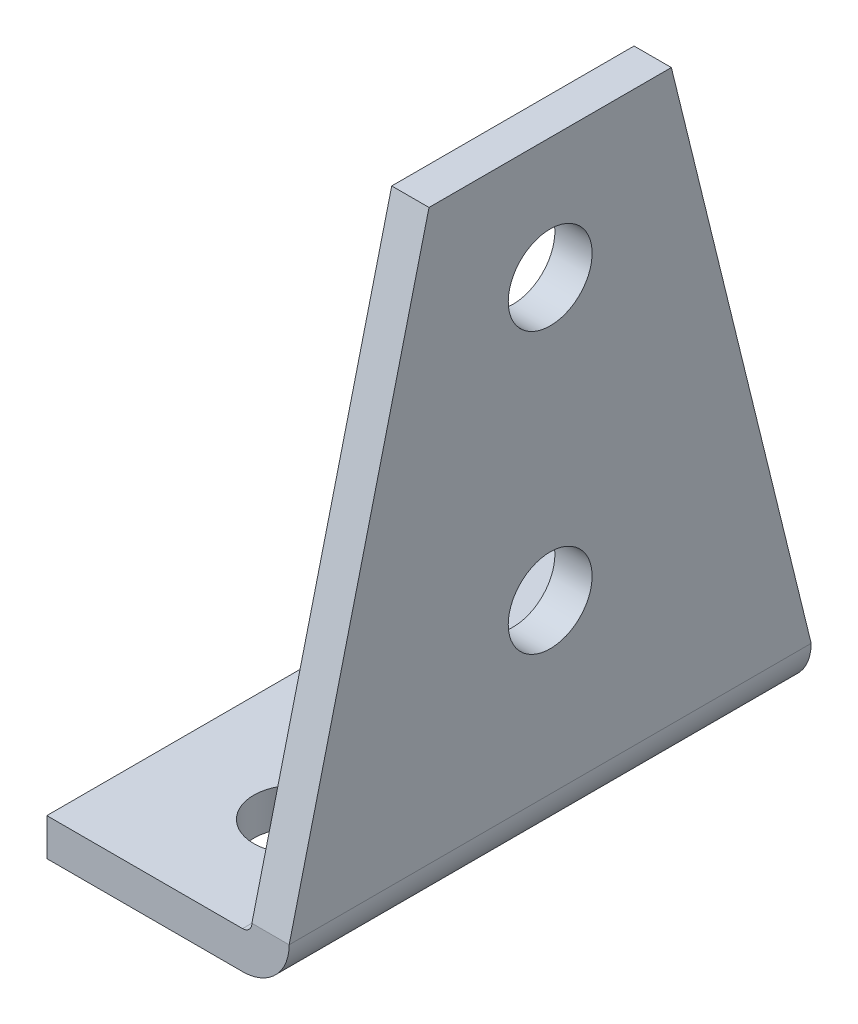
from build123d import *

# Parameters (mm, degrees)
EXTRUDE_THIN1_DEPTH     = 44.45
CUT_EXTRUDE2_DEPTH      = 120.051916196
CUT_EXTRUDE2_DEPTH_BACK = 120.051916196
SKETCH3_R               = 7.14375
CUT_EXTRUDE3_DEPTH      = 120.051916196
SKETCH4_R               = 7.14375
CUT_EXTRUDE4_DEPTH      = 116.615348246


with BuildPart() as part:
    # Sketch1 → Extrude-Thin1 (new, symmetric)
    with BuildSketch(Plane.XY):
        with BuildLine():
            Line((-41.275, 0), (-7.9375, 0))
            ThreePointArc((-7.9375, 0), (-2.324839924, 2.324839924), (0, 7.9375))
            Line((0, 7.9375), (0, 104.775))
            Line((0, 104.775), (-6.35, 104.775))
            Line((-6.35, 104.775), (-6.35, 7.9375))
            ThreePointArc((-6.35, 7.9375), (-6.814967985, 6.814967985), (-7.9375, 6.35))
            Line((-7.9375, 6.35), (-41.275, 6.35))
            Line((-41.275, 6.35), (-41.275, 0))
        make_face()
    extrude(amount=EXTRUDE_THIN1_DEPTH, both=True)

    # Sketch2 → Cut-Extrude2 (cut, two sides: drawn at the far end of the back side and taken through both)
    with BuildSketch(Plane.ZY.offset(6.35).offset(-CUT_EXTRUDE2_DEPTH_BACK)):
        Polygon((-109.618200913, -257.07985038), (-44.45, 7.9375), (-20.6375, 104.775), (20.6375, 104.775), (44.45, 7.9375), (109.618200913, -257.07985038), (109.618200913, 288.744628415), (-109.618200913, 288.744628415), align=None)
    extrude(amount=CUT_EXTRUDE2_DEPTH + CUT_EXTRUDE2_DEPTH_BACK, mode=Mode.SUBTRACT)

    # Sketch3 → Cut-Extrude3 (cut, through all)
    with BuildSketch(Plane.ZY.offset(6.35)):
        with Locations((0, 84.1375)):
            Circle(SKETCH3_R)
        with Locations((0, 36.5125)):
            Circle(SKETCH3_R)
    extrude(amount=-CUT_EXTRUDE3_DEPTH, mode=Mode.SUBTRACT)

    # Sketch4 → Cut-Extrude4 (cut, through all)
    with BuildSketch(Plane(origin=(0, 6.35, 0), x_dir=(1, 0, 0), z_dir=(0, 1, 0))):
        with Locations(Location((-19.52625, 23.8125, 0), (0, 0, 270))):
            Circle(SKETCH4_R)
        with Locations(Location((-19.52625, -23.8125, 0), (0, 0, 270))):
            Circle(SKETCH4_R)
    extrude(amount=-CUT_EXTRUDE4_DEPTH, mode=Mode.SUBTRACT)


solid = part.part
